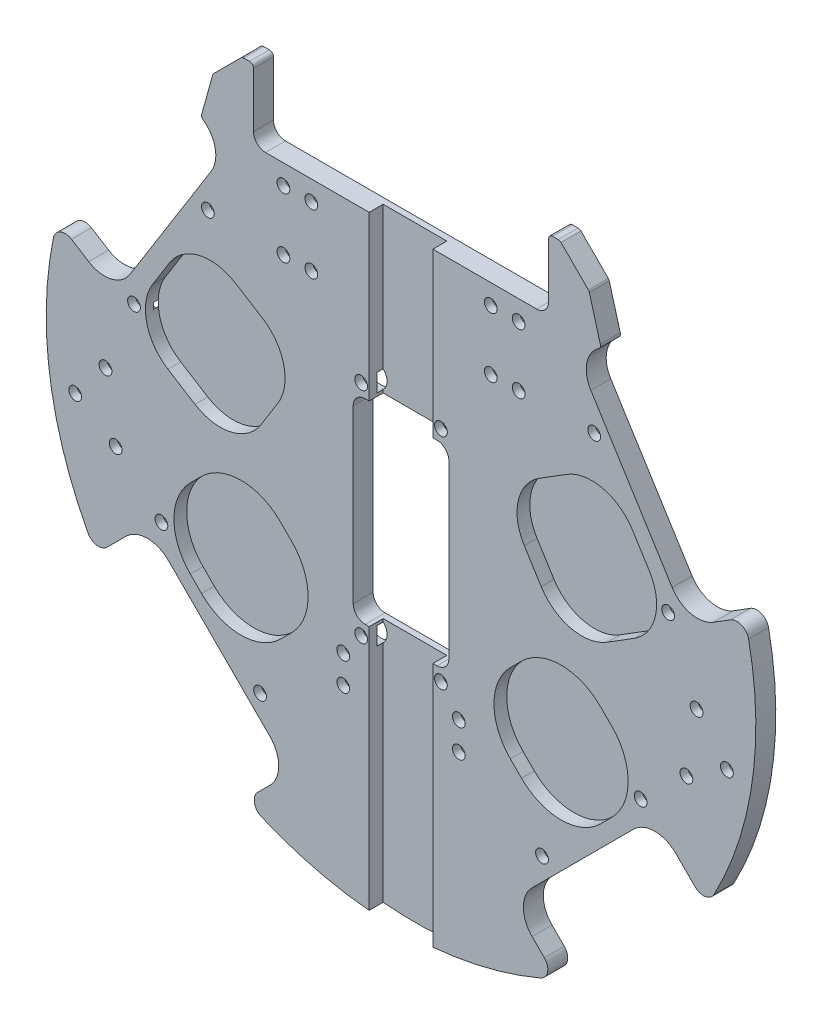
from build123d import *

# Parameters (mm, degrees)
EXTRUDE_1_DEPTH      = 5
SKETCH_5_R           = 1.6
CUT_EXTRUDE_1_DEPTH  = 126.964280651
SKETCH_6_R           = 3
CUT_EXTRUDE_2_DEPTH  = 3
CUT_EXTRUDE_6_DEPTH  = 126.964280651
SKETCH_8_W           = 16
SKETCH_8_H           = 160.287795239
CUT_EXTRUDE_7_DEPTH  = 3.5
FILLET_1_R           = 7.5
FILLET_2_R           = 3
CUT_EXTRUDE_8_DEPTH  = 3.2
CUT_EXTRUDE_12_REACH = 127.964
SKETCH_15_R          = 1.6
SKETCH_16_R          = 3
CUT_EXTRUDE_13_DEPTH = 3
FILLET_4_R           = 3
FILLET_5_R           = 1


with BuildPart() as part:
    # 草图1 → 凸台-拉伸1 (new body)
    with BuildSketch(Plane.XY):
        with BuildLine():
            Line((-57.667270539, 36.034509968), (-71.975090673, 13.137211372))
            Line((-71.975090673, 13.137211372), (-86.2270988, 22.042854454))
            ThreePointArc((-86.2270988, 22.042854454), (-88.095745205, -12.654630646), (-76.53585394, -45.423155568))
            Line((-76.53585394, -45.423155568), (-63.639610307, -32.526911935))
            Line((-63.639610307, -32.526911935), (-48.083261121, -48.083261121))
            Line((-48.083261121, -48.083261121), (-27.577164466, -68.589357775))
            Line((-27.577164466, -68.589357775), (-38.991802468, -80.003995777))
            ThreePointArc((-38.991802468, -80.003995777), (0, -89), (38.991802468, -80.003995777))
            Line((38.991802468, -80.003995777), (27.577164466, -68.589357775))
            Line((27.577164466, -68.589357775), (48.083261121, -48.083261121))
            Line((48.083261121, -48.083261121), (63.639610307, -32.526911935))
            Line((63.639610307, -32.526911935), (76.53585394, -45.423155568))
            ThreePointArc((76.53585394, -45.423155568), (88.095745205, -12.654630646), (86.2270988, 22.042854454))
            Line((86.2270988, 22.042854454), (71.975090673, 13.137211372))
            Line((71.975090673, 13.137211372), (57.667270539, 36.034509968))
            Line((57.667270539, 36.034509968), (47.598804518, 52.147423795))
            ThreePointArc((47.598804518, 52.147423795), (46.679407863, 57.926016865), (50.190947557, 62.606456701))
            Line((50.190947557, 62.606456701), (47.160877461, 73.47454065))
            Line((47.160877461, 73.47454065), (39.84564114, 80.789776971))
            Line((39.84564114, 80.789776971), (37, 80.789776971))
            Line((37, 80.789776971), (37, 63))
            Line((37, 63), (-37, 63))
            Line((-37, 63), (-37, 80.789776971))
            Line((-37, 80.789776971), (-39.84564114, 80.789776971))
            Line((-39.84564114, 80.789776971), (-47.160877461, 73.47454065))
            Line((-47.160877461, 73.47454065), (-50.190947557, 62.606456701))
            ThreePointArc((-50.190947557, 62.606456701), (-46.679407863, 57.926016865), (-47.598804518, 52.147423795))
            Line((-47.598804518, 52.147423795), (-57.667270539, 36.034509968))
        make_face()
    extrude(amount=EXTRUDE_1_DEPTH)

    # 草图5 → 切除-拉伸1 (cut, through all)
    with BuildSketch(Plane(origin=(0, 0, 0), x_dir=(-1, 0, 0), z_dir=(0, 0, -1))):
        with Locations((-10, 25)):
            Circle(SKETCH_5_R)
        with Locations((-10, -30)):
            Circle(SKETCH_5_R)
        with Locations((-22.5, 43)):
            Circle(SKETCH_5_R)
        with Locations((-22.5, 58)):
            Circle(SKETCH_5_R)
        with Locations((-14.5, -36)):
            Circle(SKETCH_5_R)
        with Locations((-14.5, -43)):
            Circle(SKETCH_5_R)
        with Locations((29.5, 58)):
            Circle(SKETCH_5_R)
        with Locations((29.5, 43)):
            Circle(SKETCH_5_R)
        with Locations((-29.5, 58)):
            Circle(SKETCH_5_R)
        with Locations((-81.739855024, -13.201505688)):
            Circle(SKETCH_5_R)
        with Locations((-74.130509203, -3.868882467)):
            Circle(SKETCH_5_R)
        with Locations((-71.579464522, -19.664203643)):
            Circle(SKETCH_5_R)
        with Locations((-29.5, 43)):
            Circle(SKETCH_5_R)
        with Locations(Location((14.5, -43, 0), (0, 0, 180))):
            Circle(SKETCH_5_R)
        with Locations(Location((14.5, -36, 0), (0, 0, 180))):
            Circle(SKETCH_5_R)
        with Locations(Location((10, -30, 0), (0, 0, 180))):
            Circle(SKETCH_5_R)
        with Locations(Location((71.579464522, -19.664203643, 0), (0, 0, 180))):
            Circle(SKETCH_5_R)
        with Locations(Location((81.739855024, -13.201505688, 0), (0, 0, 180))):
            Circle(SKETCH_5_R)
        with Locations(Location((74.130509203, -3.868882467, 0), (0, 0, 180))):
            Circle(SKETCH_5_R)
        with Locations(Location((10, 25, 0), (0, 0, 180))):
            Circle(SKETCH_5_R)
        with Locations(Location((22.5, 43, 0), (0, 0, 180))):
            Circle(SKETCH_5_R)
        with Locations(Location((22.5, 58, 0), (0, 0, 180))):
            Circle(SKETCH_5_R)
    extrude(amount=-CUT_EXTRUDE_1_DEPTH, mode=Mode.SUBTRACT)

    # 草图6 → 切除-拉伸2 (cut)
    with BuildSketch(Plane(origin=(0, 0, 0), x_dir=(-1, 0, 0), z_dir=(0, 0, -1))):
        with Locations((-22.5, 58)):
            Circle(SKETCH_6_R)
        with Locations((-29.5, 58)):
            Circle(SKETCH_6_R)
        with Locations((-22.5, 43)):
            Circle(SKETCH_6_R)
        with Locations((-29.5, 43)):
            Circle(SKETCH_6_R)
        with Locations((-10, 25)):
            Circle(SKETCH_6_R)
        with Locations((29.5, 58)):
            Circle(SKETCH_6_R)
        with Locations((-74.130509203, -3.868882467)):
            Circle(SKETCH_6_R)
        with Locations((-81.739855024, -13.201505688)):
            Circle(SKETCH_6_R)
        with Locations((-71.579464522, -19.664203643)):
            Circle(SKETCH_6_R)
        with Locations((29.5, 43)):
            Circle(SKETCH_6_R)
        with Locations((-14.5, -43)):
            Circle(SKETCH_6_R)
        with Locations((-10, -30)):
            Circle(SKETCH_6_R)
        with Locations((-14.5, -36)):
            Circle(SKETCH_6_R)
        with Locations(Location((10, -30, 0), (0, 0, 180))):
            Circle(SKETCH_6_R)
        with Locations(Location((14.5, -36, 0), (0, 0, 180))):
            Circle(SKETCH_6_R)
        with Locations(Location((14.5, -43, 0), (0, 0, 180))):
            Circle(SKETCH_6_R)
        with Locations((74.130509203, -3.868882467)):
            Circle(SKETCH_6_R)
        with Locations((81.739855024, -13.201505688)):
            Circle(SKETCH_6_R)
        with Locations((71.579464522, -19.664203643)):
            Circle(SKETCH_6_R)
        with Locations(Location((10, 25, 0), (0, 0, 180))):
            Circle(SKETCH_6_R)
        with Locations(Location((22.5, 43, 0), (0, 0, 180))):
            Circle(SKETCH_6_R)
        with Locations(Location((22.5, 58, 0), (0, 0, 180))):
            Circle(SKETCH_6_R)
    extrude(amount=-CUT_EXTRUDE_2_DEPTH, mode=Mode.SUBTRACT)

    # 草图7 → 切除-拉伸6 (cut, through all)
    with BuildSketch(Plane(origin=(0, 0, 0), x_dir=(-1, 0, 0), z_dir=(0, 0, -1))):
        with BuildLine():
            Line((12, -24), (12, 19))
            ThreePointArc((12, 19), (11.121320344, 21.121320344), (9, 22))
            Line((9, 22), (-9, 22))
            ThreePointArc((-9, 22), (-11.121320344, 21.121320344), (-12, 19))
            Line((-12, 19), (-12, -24))
            ThreePointArc((-12, -24), (-11.121320344, -26.121320344), (-9, -27))
            Line((-9, -27), (9, -27))
            ThreePointArc((9, -27), (11.121320344, -26.121320344), (12, -24))
        make_face()
    extrude(amount=-CUT_EXTRUDE_6_DEPTH, mode=Mode.SUBTRACT)

    # 草图8 → 切除-拉伸7 (cut)
    with BuildSketch(Plane.XY.offset(5)):
        with Locations((0, -14.391537873)):
            Rectangle(SKETCH_8_W, SKETCH_8_H)
    extrude(amount=-CUT_EXTRUDE_7_DEPTH, mode=Mode.SUBTRACT)

    # 圆角1
    fillet_1_edges = [part.edges().sort_by_distance(p)[0] for p in [
        (71.975090673, 13.137211372, 2.5),
        (63.639610307, -32.526911935, 2.5),
        (27.577164466, -68.589357775, 2.5),
        (-27.577164466, -68.589357775, 2.5),
        (-63.639610307, -32.526911935, 2.5),
        (-71.975090673, 13.137211372, 2.5),
    ]]
    fillet(fillet_1_edges, radius=FILLET_1_R)

    # 圆角2
    fillet_2_edges = [part.edges().sort_by_distance(p)[0] for p in [
        (86.2270988, 22.042854454, 2.5),
        (76.53585394, -45.423155568, 2.5),
        (38.991802468, -80.003995777, 2.5),
        (-38.991802468, -80.003995777, 2.5),
        (-76.53585394, -45.423155568, 2.5),
        (-86.2270988, 22.042854454, 2.5),
    ]]
    fillet(fillet_2_edges, radius=FILLET_2_R)

    # 草图9 → 切除-拉伸8 (cut)
    with BuildSketch(Plane.XY.offset(5)):
        with BuildLine():
            Line((-35.152676817, 3.270932112), (-30.913322703, 10.055316881))
            ThreePointArc((-30.913322703, 10.055316881), (-29.397459079, 19.113760704), (-34.730868686, 26.590925206))
            Line((-34.730868686, 26.590925206), (-41.515253455, 30.83027932))
            ThreePointArc((-41.515253455, 30.83027932), (-50.573697278, 32.346142943), (-58.05086178, 27.012733337))
            Line((-58.05086178, 27.012733337), (-62.290215894, 20.228348567))
            ThreePointArc((-62.290215894, 20.228348567), (-63.806079517, 11.169904745), (-58.472669911, 3.692740243))
            Line((-58.472669911, 3.692740243), (-51.688285142, -0.546613871))
            ThreePointArc((-51.688285142, -0.546613871), (-42.629841319, -2.062477495), (-35.152676817, 3.270932112))
        make_face()
        with BuildLine():
            Line((-51.452158669, -39.41895388), (-50.037945107, -40.833167443))
            ThreePointArc((-50.037945107, -40.833167443), (-40.13845017, -44.933672506), (-30.238955234, -40.833167443))
            Line((-30.238955234, -40.833167443), (-27.410528109, -38.004740318))
            ThreePointArc((-27.410528109, -38.004740318), (-23.310023045, -28.105245381), (-27.410528109, -18.205750445))
            Line((-27.410528109, -18.205750445), (-30.238955234, -15.37732332))
            ThreePointArc((-30.238955234, -15.37732332), (-40.13845017, -11.276818256), (-50.037945107, -15.37732332))
            Line((-50.037945107, -15.37732332), (-51.452158669, -16.791536882))
            Line((-51.452158669, -16.791536882), (-52.866372232, -18.205750445))
            ThreePointArc((-52.866372232, -18.205750445), (-56.966877295, -28.105245381), (-52.866372232, -38.004740318))
            Line((-52.866372232, -38.004740318), (-51.452158669, -39.41895388))
        make_face()
        with BuildLine():
            Line((58.472669911, 3.692740243), (51.688285142, -0.546613871))
            ThreePointArc((51.688285142, -0.546613871), (42.629841319, -2.062477495), (35.152676817, 3.270932112))
            Line((35.152676817, 3.270932112), (30.913322703, 10.055316881))
            ThreePointArc((30.913322703, 10.055316881), (29.397459079, 19.113760704), (34.730868686, 26.590925206))
            Line((34.730868686, 26.590925206), (41.515253455, 30.83027932))
            ThreePointArc((41.515253455, 30.83027932), (50.573697278, 32.346142943), (58.05086178, 27.012733337))
            Line((58.05086178, 27.012733337), (62.290215894, 20.228348567))
            ThreePointArc((62.290215894, 20.228348567), (63.806079517, 11.169904745), (58.472669911, 3.692740243))
        make_face()
        with BuildLine():
            Line((30.238955234, -15.37732332), (27.410528109, -18.205750445))
            ThreePointArc((27.410528109, -18.205750445), (23.310023045, -28.105245381), (27.410528109, -38.004740318))
            Line((27.410528109, -38.004740318), (30.238955234, -40.833167443))
            ThreePointArc((30.238955234, -40.833167443), (40.13845017, -44.933672506), (50.037945107, -40.833167443))
            Line((50.037945107, -40.833167443), (51.452158669, -39.41895388))
            Line((51.452158669, -39.41895388), (52.866372232, -38.004740318))
            ThreePointArc((52.866372232, -38.004740318), (56.966877295, -28.105245381), (52.866372232, -18.205750445))
            Line((52.866372232, -18.205750445), (51.452158669, -16.791536882))
            Line((51.452158669, -16.791536882), (50.037945107, -15.37732332))
            ThreePointArc((50.037945107, -15.37732332), (40.13845017, -11.276818256), (30.238955234, -15.37732332))
        make_face()
    extrude(amount=-CUT_EXTRUDE_8_DEPTH, mode=Mode.SUBTRACT)

    # 草图15 → 切除-拉伸12 (cut, up to next)
    with BuildSketch(Plane.XY.offset(5), mode=Mode.PRIVATE) as cut_extrude_12_sk1:
        with Locations((-66.993140496, 13.561678603)):
            Circle(SKETCH_15_R)
    cut_extrude_12_tool1 = extrude(cut_extrude_12_sk1.sketch, amount=-CUT_EXTRUDE_12_REACH, mode=Mode.PRIVATE) & part.part
    # 草图15 → 切除-拉伸12 (cut, up to next)
    with BuildSketch(Plane.XY.offset(5), mode=Mode.PRIVATE) as cut_extrude_12_sk2:
        with Locations((-48.445966247, 43.243361969)):
            Circle(SKETCH_15_R)
    cut_extrude_12_tool2 = extrude(cut_extrude_12_sk2.sketch, amount=-CUT_EXTRUDE_12_REACH, mode=Mode.PRIVATE) & part.part
    # 草图15 → 切除-拉伸12 (cut, up to next)
    with BuildSketch(Plane.XY.offset(5), mode=Mode.PRIVATE) as cut_extrude_12_sk3:
        with Locations((-60.104076401, -30.405591591)):
            Circle(SKETCH_15_R)
    cut_extrude_12_tool3 = extrude(cut_extrude_12_sk3.sketch, amount=-CUT_EXTRUDE_12_REACH, mode=Mode.PRIVATE) & part.part
    # 草图15 → 切除-拉伸12 (cut, up to next)
    with BuildSketch(Plane.XY.offset(5), mode=Mode.PRIVATE) as cut_extrude_12_sk4:
        with Locations((-35.355339059, -55.154328933)):
            Circle(SKETCH_15_R)
    cut_extrude_12_tool4 = extrude(cut_extrude_12_sk4.sketch, amount=-CUT_EXTRUDE_12_REACH, mode=Mode.PRIVATE) & part.part
    # 草图15 → 切除-拉伸12 (cut, up to next)
    with BuildSketch(Plane.XY.offset(5), mode=Mode.PRIVATE) as cut_extrude_12_sk5:
        with Locations((35.355339059, -55.154328933)):
            Circle(SKETCH_15_R)
    cut_extrude_12_tool5 = extrude(cut_extrude_12_sk5.sketch, amount=-CUT_EXTRUDE_12_REACH, mode=Mode.PRIVATE) & part.part
    # 草图15 → 切除-拉伸12 (cut, up to next)
    with BuildSketch(Plane.XY.offset(5), mode=Mode.PRIVATE) as cut_extrude_12_sk6:
        with Locations((60.104076401, -30.405591591)):
            Circle(SKETCH_15_R)
    cut_extrude_12_tool6 = extrude(cut_extrude_12_sk6.sketch, amount=-CUT_EXTRUDE_12_REACH, mode=Mode.PRIVATE) & part.part
    # 草图15 → 切除-拉伸12 (cut, up to next)
    with BuildSketch(Plane.XY.offset(5), mode=Mode.PRIVATE) as cut_extrude_12_sk7:
        with Locations((66.993140496, 13.561678603)):
            Circle(SKETCH_15_R)
    cut_extrude_12_tool7 = extrude(cut_extrude_12_sk7.sketch, amount=-CUT_EXTRUDE_12_REACH, mode=Mode.PRIVATE) & part.part
    # 草图15 → 切除-拉伸12 (cut, up to next)
    with BuildSketch(Plane.XY.offset(5), mode=Mode.PRIVATE) as cut_extrude_12_sk8:
        with Locations((48.445966247, 43.243361969)):
            Circle(SKETCH_15_R)
    cut_extrude_12_tool8 = extrude(cut_extrude_12_sk8.sketch, amount=-CUT_EXTRUDE_12_REACH, mode=Mode.PRIVATE) & part.part
    add(cut_extrude_12_tool1.solids().sort_by_distance((-66.99314, 13.561679, 5))[0], mode=Mode.SUBTRACT)
    add(cut_extrude_12_tool2.solids().sort_by_distance((-48.445966, 43.243362, 5))[0], mode=Mode.SUBTRACT)
    add(cut_extrude_12_tool3.solids().sort_by_distance((-60.104076, -30.405592, 5))[0], mode=Mode.SUBTRACT)
    add(cut_extrude_12_tool4.solids().sort_by_distance((-35.355339, -55.154329, 5))[0], mode=Mode.SUBTRACT)
    add(cut_extrude_12_tool5.solids().sort_by_distance((35.355339, -55.154329, 5))[0], mode=Mode.SUBTRACT)
    add(cut_extrude_12_tool6.solids().sort_by_distance((60.104076, -30.405592, 5))[0], mode=Mode.SUBTRACT)
    add(cut_extrude_12_tool7.solids().sort_by_distance((66.99314, 13.561679, 5))[0], mode=Mode.SUBTRACT)
    add(cut_extrude_12_tool8.solids().sort_by_distance((48.445966, 43.243362, 5))[0], mode=Mode.SUBTRACT)

    # 草图16 → 切除-拉伸13 (cut)
    with BuildSketch(Plane(origin=(0, 0, 0), x_dir=(-1, 0, 0), z_dir=(0, 0, -1))):
        with Locations((-60.104076401, -30.405591591)):
            Circle(SKETCH_16_R)
        with Locations((-35.355339059, -55.154328933)):
            Circle(SKETCH_16_R)
        with Locations((-66.993140496, 13.561678603)):
            Circle(SKETCH_16_R)
        with Locations((-48.445966247, 43.243361969)):
            Circle(SKETCH_16_R)
        with Locations((48.445966247, 43.243361969)):
            Circle(SKETCH_16_R)
        with Locations((66.993140496, 13.561678603)):
            Circle(SKETCH_16_R)
        with Locations((60.104076401, -30.405591591)):
            Circle(SKETCH_16_R)
        with Locations((35.355339059, -55.154328933)):
            Circle(SKETCH_16_R)
    extrude(amount=-CUT_EXTRUDE_13_DEPTH, mode=Mode.SUBTRACT)

    # 圆角4
    fillet_4_edges = [part.edges().sort_by_distance(p)[0] for p in [
        (-37, 63, 2.5),
        (37, 63, 2.5),
    ]]
    fillet(fillet_4_edges, radius=FILLET_4_R)

    # 圆角5
    fillet_5_edges = [part.edges().sort_by_distance(p)[0] for p in [
        (-50.190947557, 62.606456701, 2.5),
        (-47.160877461, 73.47454065, 2.5),
        (-39.84564114, 80.789776971, 2.5),
        (-37, 80.789776971, 2.5),
        (37, 80.789776971, 2.5),
        (39.84564114, 80.789776971, 2.5),
        (47.160877461, 73.47454065, 2.5),
        (50.190947557, 62.606456701, 2.5),
    ]]
    fillet(fillet_5_edges, radius=FILLET_5_R)


solid = part.part
